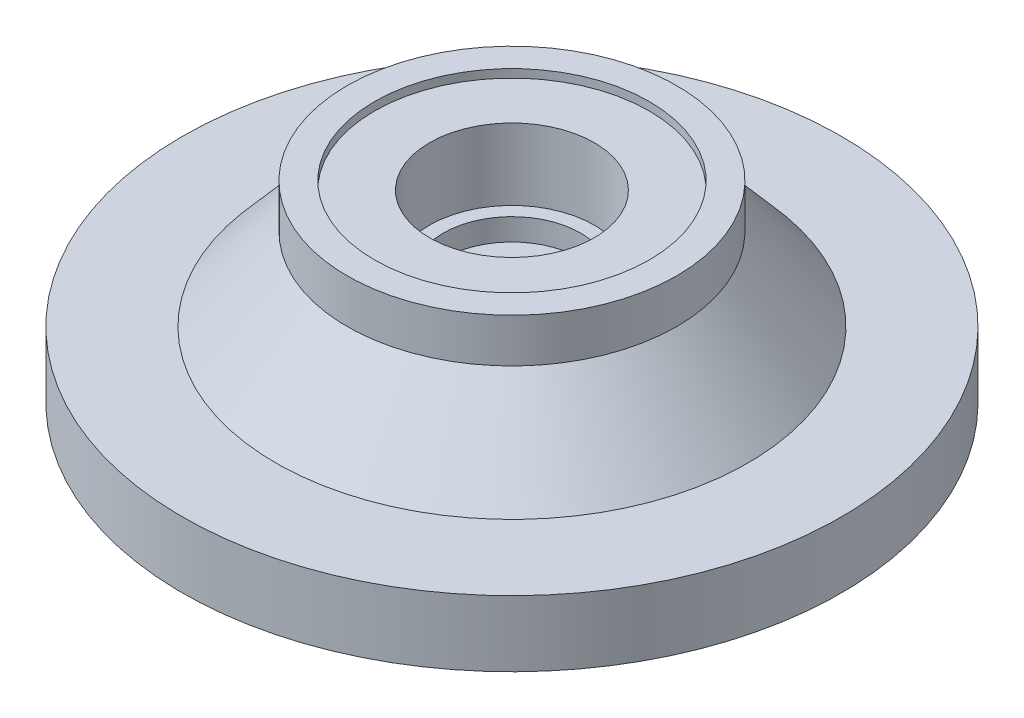
from build123d import *

# Parameters (mm, degrees)
CROQUIS2_R            = 43
CORTAR_EXTRUIR1_DEPTH = 2
CROQUIS4_R            = 40
CORTAR_EXTRUIR2_DEPTH = 3
CORTAR_EXTRUIR3_START = -8.5
CROQUIS6_R            = 30
CORTAR_EXTRUIR3_DEPTH = 8.5
CORTAR_EXTRUIR4_START = -1
CROQUIS8_R            = 30
CORTAR_EXTRUIR4_DEPTH = 1
CROQUIS9_R            = 25
CORTAR_EXTRUIR5_DEPTH = 1.5
CROQUIS10_R           = 15
CORTAR_EXTRUIR6_DEPTH = 13
CROQUIS11_R           = 12.5
CORTAR_EXTRUIR7_DEPTH = 18.5
CROQUIS12_R           = 9
CORTAR_EXTRUIR8_DEPTH = 22.5


with BuildPart() as part:
    # Croquis1 → Revolución1 (revolve)
    with BuildSketch(Plane.XY):
        Polygon((0, 0), (60, 0), (60, 12), (43, 12), (30, 27), (30, 35), (0, 35), align=None)
    revolve(axis=Axis((0, 35, 0), (0, -1, 0)))

    # Croquis2 → Cortar-Extruir1 (cut)
    with BuildSketch(Plane.XZ):
        Circle(CROQUIS2_R)
    extrude(amount=-CORTAR_EXTRUIR1_DEPTH, mode=Mode.SUBTRACT)

    # Croquis4 → Cortar-Extruir2 (cut)
    with BuildSketch(Plane.XZ.offset(-2)):
        Circle(CROQUIS4_R)
    extrude(amount=-CORTAR_EXTRUIR2_DEPTH, mode=Mode.SUBTRACT)

    # Croquis5 → Revolución2 (revolve)
    with BuildSketch(Plane.XY):
        Polygon((-43, 2), (-43, 0), (-40, 2), align=None)
    revolve(axis=Axis((0, 0, 0), (0, 1, 0)))

    # Croquis6 → Cortar-Extruir3 (cut)
    with BuildSketch(Plane.XZ.offset(-5).offset(CORTAR_EXTRUIR3_START)):
        Circle(CROQUIS6_R)
    extrude(amount=CORTAR_EXTRUIR3_DEPTH, mode=Mode.SUBTRACT)

    # Croquis7 → Cortar-Revolución1 (revolve, cut)
    with BuildSketch(Plane.XY):
        Polygon((-40, 5), (-30, 5), (-30, 13.5), align=None)
    revolve(axis=Axis((0, 0, 0), (0, 1, 0)), mode=Mode.SUBTRACT)

    # Croquis8 → Cortar-Extruir4 (cut)
    with BuildSketch(Plane.XZ.offset(-13.5).offset(CORTAR_EXTRUIR4_START)):
        Circle(CROQUIS8_R)
    extrude(amount=CORTAR_EXTRUIR4_DEPTH, mode=Mode.SUBTRACT)

    # Croquis9 → Cortar-Extruir5 (cut)
    with BuildSketch(Plane(origin=(0, 35, 0), x_dir=(1, 0, 0), z_dir=(0, 1, 0))):
        Circle(CROQUIS9_R)
    extrude(amount=-CORTAR_EXTRUIR5_DEPTH, mode=Mode.SUBTRACT)

    # Croquis10 → Cortar-Extruir6 (cut)
    with BuildSketch(Plane(origin=(0, 33.5, 0), x_dir=(1, 0, 0), z_dir=(0, 1, 0))):
        Circle(CROQUIS10_R)
    extrude(amount=-CORTAR_EXTRUIR6_DEPTH, mode=Mode.SUBTRACT)

    # Croquis11 → Cortar-Extruir7 (cut)
    with BuildSketch(Plane(origin=(0, 35, 0), x_dir=(1, 0, 0), z_dir=(0, 1, 0))):
        Circle(CROQUIS11_R)
    extrude(amount=-CORTAR_EXTRUIR7_DEPTH, mode=Mode.SUBTRACT)

    # Croquis12 → Cortar-Extruir8 (cut)
    with BuildSketch(Plane(origin=(0, 35, 0), x_dir=(1, 0, 0), z_dir=(0, 1, 0))):
        Circle(CROQUIS12_R)
    extrude(amount=-CORTAR_EXTRUIR8_DEPTH, mode=Mode.SUBTRACT)


solid = part.part
